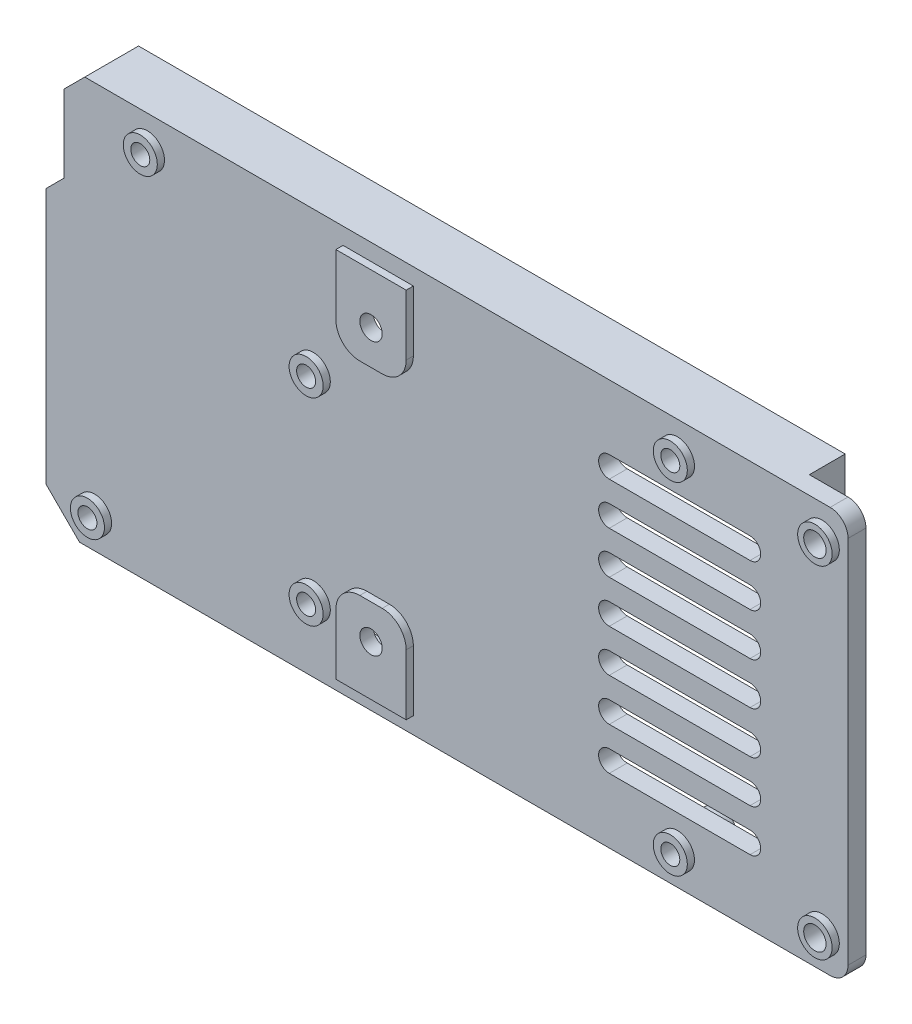
from build123d import *
from build123d.topology import SkipClean

# Parameters (mm, degrees)
BOSS_EXTRUDE2_DEPTH = 5.08
SKETCH3_R           = 1.5875
SKETCH3_R_2         = 1.3462
BOSS_EXTRUDE3_DEPTH = 2.54
BOSS_EXTRUDE4_START = 3.4671
SKETCH4_R           = 2.413
SKETCH4_R_2         = 1.3462
BOSS_EXTRUDE4_DEPTH = 3.4671
CUT_EXTRUDE1_REACH  = 69.495
SKETCH6_R           = 2.413
SKETCH6_R_2         = 1.3462
SKETCH6_R_3         = 2.44475
SKETCH6_R_4         = 1.5875
BOSS_EXTRUDE5_DEPTH = 1.016
CUT_EXTRUDE2_DEPTH  = 1.6383
CUT_EXTRUDE3_REACH  = 69.638
SKETCH9_R           = 1.5875
FILLET1_R           = 2.54


with BuildPart() as part:
    # Sketch2 → Boss-Extrude2 (new body)
    with BuildSketch(Plane.XY):
        Polygon((52.832, 28.7401), (-47.338246659, 28.7401), (-50.292, 25.786346659), (-50.292, 14.849781959), (-52.832, 12.309781959), (-52.832, -23.993781959), (-48.085681959, -28.7401), (52.832, -28.7401), align=None)
        Polygon((50.8, 26.7081), (-46.4965647, 26.7081), (-48.26, 24.9446647), (-48.26, 14.0081), (-50.8, 11.4681), (-50.8, -23.1521), (-47.244, -26.7081), (50.8, -26.7081), align=None, mode=Mode.SUBTRACT)
    extrude(amount=BOSS_EXTRUDE2_DEPTH)

    # Sketch3 → Boss-Extrude3 (add)
    with BuildSketch(Plane.XY.offset(5.08)):
        Polygon((-48.085681959, -28.7401), (60.8584, -28.7401), (60.8584, 28.7401), (-47.338246659, 28.7401), (-50.292, 25.786346659), (-50.292, 14.849781959), (-52.832, 12.309781959), (-52.832, -23.993781959), align=None)
        with Locations((57.1754, 24.1681)):
            Circle(SKETCH3_R, mode=Mode.SUBTRACT)
        with Locations((57.1754, -24.1681)):
            Circle(SKETCH3_R, mode=Mode.SUBTRACT)
        with Locations((36.6776, 24.1681)):
            Circle(SKETCH3_R_2, mode=Mode.SUBTRACT)
        with Locations((-38.4556, 24.1681)):
            Circle(SKETCH3_R_2, mode=Mode.SUBTRACT)
        with Locations((-14.9479, 8.726592766)):
            Circle(SKETCH3_R_2, mode=Mode.SUBTRACT)
        with Locations((-14.9479, -19.289607234)):
            Circle(SKETCH3_R_2, mode=Mode.SUBTRACT)
        with Locations((-45.9486, -24.1681)):
            Circle(SKETCH3_R_2, mode=Mode.SUBTRACT)
        with Locations((36.6776, -24.1681)):
            Circle(SKETCH3_R_2, mode=Mode.SUBTRACT)
    extrude(amount=BOSS_EXTRUDE3_DEPTH)

    # Sketch4 → Boss-Extrude4 (add)
    # profile 1 of 6: a face of its own
    with SkipClean():  # the faces are left unmerged after this step: merging them gives an invalid solid
        with BuildSketch(Plane(origin=(0, 0, 5.08), x_dir=(-1, 0, 0), z_dir=(0, 0, -1)).offset(BOSS_EXTRUDE4_START)):
            with Locations((14.9479, 8.726592766)):
                Circle(SKETCH4_R)
            with Locations((14.9479, 8.726592766)):
                Circle(SKETCH4_R_2, mode=Mode.SUBTRACT)
        # profile 2 of 6: a face of its own
        with BuildSketch(Plane(origin=(0, 0, 5.08), x_dir=(-1, 0, 0), z_dir=(0, 0, -1)).offset(BOSS_EXTRUDE4_START)):
            with Locations((14.9479, -19.289607234)):
                Circle(SKETCH4_R)
            with Locations((14.9479, -19.289607234)):
                Circle(SKETCH4_R_2, mode=Mode.SUBTRACT)
        # profile 3 of 6: a face of its own
        with BuildSketch(Plane(origin=(0, 0, 5.08), x_dir=(-1, 0, 0), z_dir=(0, 0, -1)).offset(BOSS_EXTRUDE4_START)):
            with BuildLine():
                Line((-39.0906, 24.1681), (-39.0906, 26.7081))
                Line((-39.0906, 26.7081), (-34.2646, 26.7081))
                Line((-34.2646, 26.7081), (-34.2646, 24.1681))
                ThreePointArc((-34.2646, 24.1681), (-36.6776, 21.7551), (-39.0906, 24.1681))
            make_face()
            with Locations((-36.6776, 24.1681)):
                Circle(SKETCH4_R_2, mode=Mode.SUBTRACT)
        # profile 4 of 6: a face of its own
        with BuildSketch(Plane(origin=(0, 0, 5.08), x_dir=(-1, 0, 0), z_dir=(0, 0, -1)).offset(BOSS_EXTRUDE4_START)):
            with BuildLine():
                Line((36.0426, 24.1681), (36.0426, 26.7081))
                Line((36.0426, 26.7081), (40.8686, 26.7081))
                Line((40.8686, 26.7081), (40.8686, 24.1681))
                ThreePointArc((40.8686, 24.1681), (38.4556, 21.7551), (36.0426, 24.1681))
            make_face()
            with Locations((38.4556, 24.1681)):
                Circle(SKETCH4_R_2, mode=Mode.SUBTRACT)
        # profile 5 of 6: a face of its own
        with BuildSketch(Plane(origin=(0, 0, 5.08), x_dir=(-1, 0, 0), z_dir=(0, 0, -1)).offset(BOSS_EXTRUDE4_START)):
            with BuildLine():
                Line((48.3616, -24.1681), (49.784, -24.1681))
                Line((49.784, -24.1681), (47.244, -26.7081))
                Line((47.244, -26.7081), (43.5356, -26.7081))
                Line((43.5356, -26.7081), (43.5356, -24.1681))
                ThreePointArc((43.5356, -24.1681), (45.9486, -21.7551), (48.3616, -24.1681))
            make_face()
            with Locations((45.9486, -24.1681)):
                Circle(SKETCH4_R_2, mode=Mode.SUBTRACT)
        # profile 6 of 6: a face of its own
        with BuildSketch(Plane(origin=(0, 0, 5.08), x_dir=(-1, 0, 0), z_dir=(0, 0, -1)).offset(BOSS_EXTRUDE4_START)):
            with BuildLine():
                Line((-39.0906, -24.1681), (-39.0906, -26.7081))
                Line((-39.0906, -26.7081), (-34.2646, -26.7081))
                Line((-34.2646, -26.7081), (-34.2646, -24.1681))
                ThreePointArc((-34.2646, -24.1681), (-36.6776, -21.7551), (-39.0906, -24.1681))
            make_face()
            with Locations((-36.6776, -24.1681)):
                Circle(SKETCH4_R_2, mode=Mode.SUBTRACT)
        extrude(amount=-BOSS_EXTRUDE4_DEPTH)

    # Sketch5 → Cut-Extrude1 (cut, up to next)
    with BuildSketch(Plane(origin=(0, 0, 5.08), x_dir=(-1, 0, 0), z_dir=(0, 0, -1)), mode=Mode.PRIVATE) as cut_extrude1_sk1:
        with BuildLine():
            Line((-46.9646, 19.5707), (-27.0129, 19.5707))
            ThreePointArc((-27.0129, 19.5707), (-25.5016, 18.0594), (-27.0129, 16.5481))
            Line((-27.0129, 16.5481), (-46.9646, 16.5481))
            ThreePointArc((-46.9646, 16.5481), (-48.4759, 18.0594), (-46.9646, 19.5707))
        make_face()
    cut_extrude1_tool1 = extrude(cut_extrude1_sk1.sketch, amount=-CUT_EXTRUDE1_REACH, mode=Mode.PRIVATE) & part.part
    # Sketch5 → Cut-Extrude1 (cut, up to next)
    with BuildSketch(Plane(origin=(0, 0, 5.08), x_dir=(-1, 0, 0), z_dir=(0, 0, -1)), mode=Mode.PRIVATE) as cut_extrude1_sk2:
        with BuildLine():
            Line((-46.9646, 13.5509), (-27.0129, 13.5509))
            ThreePointArc((-27.0129, 13.5509), (-25.5016, 12.0396), (-27.0129, 10.5283))
            Line((-27.0129, 10.5283), (-46.9646, 10.5283))
            ThreePointArc((-46.9646, 10.5283), (-48.4759, 12.0396), (-46.9646, 13.5509))
        make_face()
    cut_extrude1_tool2 = extrude(cut_extrude1_sk2.sketch, amount=-CUT_EXTRUDE1_REACH, mode=Mode.PRIVATE) & part.part
    # Sketch5 → Cut-Extrude1 (cut, up to next)
    with BuildSketch(Plane(origin=(0, 0, 5.08), x_dir=(-1, 0, 0), z_dir=(0, 0, -1)), mode=Mode.PRIVATE) as cut_extrude1_sk3:
        with BuildLine():
            Line((-46.9646, 7.5311), (-27.0129, 7.5311))
            ThreePointArc((-27.0129, 7.5311), (-25.5016, 6.0198), (-27.0129, 4.5085))
            Line((-27.0129, 4.5085), (-46.9646, 4.5085))
            ThreePointArc((-46.9646, 4.5085), (-48.4759, 6.0198), (-46.9646, 7.5311))
        make_face()
    cut_extrude1_tool3 = extrude(cut_extrude1_sk3.sketch, amount=-CUT_EXTRUDE1_REACH, mode=Mode.PRIVATE) & part.part
    # Sketch5 → Cut-Extrude1 (cut, up to next)
    with BuildSketch(Plane(origin=(0, 0, 5.08), x_dir=(-1, 0, 0), z_dir=(0, 0, -1)), mode=Mode.PRIVATE) as cut_extrude1_sk4:
        with BuildLine():
            Line((-46.9646, 1.5113), (-27.0129, 1.5113))
            ThreePointArc((-27.0129, 1.5113), (-25.5016, 0), (-27.0129, -1.5113))
            Line((-27.0129, -1.5113), (-46.9646, -1.5113))
            ThreePointArc((-46.9646, -1.5113), (-48.4759, 0), (-46.9646, 1.5113))
        make_face()
    cut_extrude1_tool4 = extrude(cut_extrude1_sk4.sketch, amount=-CUT_EXTRUDE1_REACH, mode=Mode.PRIVATE) & part.part
    # Sketch5 → Cut-Extrude1 (cut, up to next)
    with BuildSketch(Plane(origin=(0, 0, 5.08), x_dir=(-1, 0, 0), z_dir=(0, 0, -1)), mode=Mode.PRIVATE) as cut_extrude1_sk5:
        with BuildLine():
            Line((-46.9646, -4.5085), (-27.0129, -4.5085))
            ThreePointArc((-27.0129, -4.5085), (-25.5016, -6.0198), (-27.0129, -7.5311))
            Line((-27.0129, -7.5311), (-46.9646, -7.5311))
            ThreePointArc((-46.9646, -7.5311), (-48.4759, -6.0198), (-46.9646, -4.5085))
        make_face()
    cut_extrude1_tool5 = extrude(cut_extrude1_sk5.sketch, amount=-CUT_EXTRUDE1_REACH, mode=Mode.PRIVATE) & part.part
    # Sketch5 → Cut-Extrude1 (cut, up to next)
    with BuildSketch(Plane(origin=(0, 0, 5.08), x_dir=(-1, 0, 0), z_dir=(0, 0, -1)), mode=Mode.PRIVATE) as cut_extrude1_sk6:
        with BuildLine():
            Line((-46.9646, -10.5283), (-27.0129, -10.5283))
            ThreePointArc((-27.0129, -10.5283), (-25.5016, -12.0396), (-27.0129, -13.5509))
            Line((-27.0129, -13.5509), (-46.9646, -13.5509))
            ThreePointArc((-46.9646, -13.5509), (-48.4759, -12.0396), (-46.9646, -10.5283))
        make_face()
    cut_extrude1_tool6 = extrude(cut_extrude1_sk6.sketch, amount=-CUT_EXTRUDE1_REACH, mode=Mode.PRIVATE) & part.part
    # Sketch5 → Cut-Extrude1 (cut, up to next)
    with BuildSketch(Plane(origin=(0, 0, 5.08), x_dir=(-1, 0, 0), z_dir=(0, 0, -1)), mode=Mode.PRIVATE) as cut_extrude1_sk7:
        with BuildLine():
            Line((-46.9646, -16.5481), (-27.0129, -16.5481))
            ThreePointArc((-27.0129, -16.5481), (-25.5016, -18.0594), (-27.0129, -19.5707))
            Line((-27.0129, -19.5707), (-46.9646, -19.5707))
            ThreePointArc((-46.9646, -19.5707), (-48.4759, -18.0594), (-46.9646, -16.5481))
        make_face()
    cut_extrude1_tool7 = extrude(cut_extrude1_sk7.sketch, amount=-CUT_EXTRUDE1_REACH, mode=Mode.PRIVATE) & part.part
    add(cut_extrude1_tool1.solids().sort_by_distance((36.98875, 18.0594, 5.08))[0], mode=Mode.SUBTRACT)
    add(cut_extrude1_tool2.solids().sort_by_distance((36.98875, 12.0396, 5.08))[0], mode=Mode.SUBTRACT)
    add(cut_extrude1_tool3.solids().sort_by_distance((36.98875, 6.0198, 5.08))[0], mode=Mode.SUBTRACT)
    add(cut_extrude1_tool4.solids().sort_by_distance((36.98875, 0, 5.08))[0], mode=Mode.SUBTRACT)
    add(cut_extrude1_tool5.solids().sort_by_distance((36.98875, -6.0198, 5.08))[0], mode=Mode.SUBTRACT)
    add(cut_extrude1_tool6.solids().sort_by_distance((36.98875, -12.0396, 5.08))[0], mode=Mode.SUBTRACT)
    add(cut_extrude1_tool7.solids().sort_by_distance((36.98875, -18.0594, 5.08))[0], mode=Mode.SUBTRACT)

    # Sketch6 → Boss-Extrude5 (add)
    # profile 1 of 10: a face of its own
    with BuildSketch(Plane.XY.offset(7.62)):
        with Locations(Location((-14.9479, -19.289607234, 0), (0, 0, 180))):
            Circle(SKETCH6_R)
        with Locations(Location((-14.9479, -19.289607234, 0), (0, 0, 180))):
            Circle(SKETCH6_R_2, mode=Mode.SUBTRACT)
    # profile 2 of 10: a face of its own
    with BuildSketch(Plane.XY.offset(7.62)):
        with Locations(Location((-14.9479, 8.726592766, 0), (0, 0, 180))):
            Circle(SKETCH6_R)
        with Locations(Location((-14.9479, 8.726592766, 0), (0, 0, 180))):
            Circle(SKETCH6_R_2, mode=Mode.SUBTRACT)
    # profile 3 of 10: a face of its own
    with BuildSketch(Plane.XY.offset(7.62)):
        with Locations(Location((-45.9486, -24.1681, 0), (0, 0, 180))):
            Circle(SKETCH6_R)
        with Locations(Location((-45.9486, -24.1681, 0), (0, 0, 180))):
            Circle(SKETCH6_R_2, mode=Mode.SUBTRACT)
    # profile 4 of 10: a face of its own
    with BuildSketch(Plane.XY.offset(7.62)):
        with Locations(Location((-38.4556, 24.1681, 0), (0, 0, 180))):
            Circle(SKETCH6_R)
        with Locations(Location((-38.4556, 24.1681, 0), (0, 0, 180))):
            Circle(SKETCH6_R_2, mode=Mode.SUBTRACT)
    # profile 5 of 10: a face of its own
    with BuildSketch(Plane.XY.offset(7.62)):
        with Locations(Location((36.6776, 24.1681, 0), (0, 0, 180))):
            Circle(SKETCH6_R)
        with Locations(Location((36.6776, 24.1681, 0), (0, 0, 180))):
            Circle(SKETCH6_R_2, mode=Mode.SUBTRACT)
    # profile 6 of 10: a face of its own
    with BuildSketch(Plane.XY.offset(7.62)):
        with Locations(Location((36.6776, -24.1681, 0), (0, 0, 180))):
            Circle(SKETCH6_R)
        with Locations(Location((36.6776, -24.1681, 0), (0, 0, 180))):
            Circle(SKETCH6_R_2, mode=Mode.SUBTRACT)
    # profile 7 of 10: a face of its own
    with BuildSketch(Plane.XY.offset(7.62)):
        with Locations(Location((57.1754, 24.1681, 0), (0, 0, 180))):
            Circle(SKETCH6_R_3)
        with Locations((57.1754, 24.1681)):
            Circle(SKETCH6_R_4, mode=Mode.SUBTRACT)
    # profile 8 of 10: a face of its own
    with BuildSketch(Plane.XY.offset(7.62)):
        with Locations(Location((57.1754, -24.1681, 0), (0, 0, 180))):
            Circle(SKETCH6_R_3)
        with Locations((57.1754, -24.1681)):
            Circle(SKETCH6_R_4, mode=Mode.SUBTRACT)
    # profile 9 of 10: a face of its own
    with BuildSketch(Plane.XY.offset(7.62)):
        with BuildLine():
            Line((-7.33425, -14.3891), (-4.15925, -14.3891))
            ThreePointArc((-4.15925, -14.3891), (-1.757031488, -15.384131488), (-0.762, -17.78635))
            Line((-0.762, -17.78635), (-0.762, -26.3779))
            Line((-0.762, -26.3779), (-10.7315, -26.3779))
            Line((-10.7315, -26.3779), (-10.7315, -17.78635))
            ThreePointArc((-10.7315, -17.78635), (-9.736468512, -15.384131488), (-7.33425, -14.3891))
        make_face()
        with Locations((-5.74675, -19.289607234)):
            Circle(SKETCH6_R_4, mode=Mode.SUBTRACT)
    # profile 10 of 10: a face of its own
    with BuildSketch(Plane.XY.offset(7.62)):
        with BuildLine():
            Line((-10.7315, 26.3779), (-10.7315, 17.78635))
            ThreePointArc((-10.7315, 17.78635), (-9.736468512, 15.384131488), (-7.33425, 14.3891))
            Line((-7.33425, 14.3891), (-4.15925, 14.3891))
            ThreePointArc((-4.15925, 14.3891), (-1.757031488, 15.384131488), (-0.762, 17.78635))
            Line((-0.762, 17.78635), (-0.762, 26.3779))
            Line((-0.762, 26.3779), (-10.7315, 26.3779))
        make_face()
        with Locations(Location((-5.74675, 19.289607234, 0), (0, 0, 180))):
            Circle(SKETCH6_R_4, mode=Mode.SUBTRACT)
    extrude(amount=BOSS_EXTRUDE5_DEPTH)

    # Sketch8 → Cut-Extrude2 (cut)
    with BuildSketch(Plane(origin=(0, 0, 5.08), x_dir=(-1, 0, 0), z_dir=(0, 0, -1))):
        with BuildLine():
            Line((9.8425, 17.78635), (9.8425, 25.4889))
            Line((9.8425, 25.4889), (1.651, 25.4889))
            Line((1.651, 25.4889), (1.651, 17.78635))
            ThreePointArc((1.651, 17.78635), (2.385649416, 16.012749416), (4.15925, 15.2781))
            Line((4.15925, 15.2781), (7.33425, 15.2781))
            ThreePointArc((7.33425, 15.2781), (9.107850584, 16.012749416), (9.8425, 17.78635))
        make_face()
        with BuildLine():
            Line((1.651, -25.4889), (9.8425, -25.4889))
            Line((9.8425, -25.4889), (9.8425, -17.78635))
            ThreePointArc((9.8425, -17.78635), (9.107850584, -16.012749416), (7.33425, -15.2781))
            Line((7.33425, -15.2781), (4.15925, -15.2781))
            ThreePointArc((4.15925, -15.2781), (2.385649416, -16.012749416), (1.651, -17.78635))
            Line((1.651, -17.78635), (1.651, -25.4889))
        make_face()
    extrude(amount=-CUT_EXTRUDE2_DEPTH, mode=Mode.SUBTRACT)

    # Sketch9 → Cut-Extrude3 (cut, up to next)
    with BuildSketch(Plane(origin=(0, 0, 6.7183), x_dir=(-1, 0, 0), z_dir=(0, 0, -1)), mode=Mode.PRIVATE) as cut_extrude3_sk1:
        with Locations((5.74675, -19.289607234)):
            Circle(SKETCH9_R)
    cut_extrude3_tool1 = extrude(cut_extrude3_sk1.sketch, amount=-CUT_EXTRUDE3_REACH, mode=Mode.PRIVATE) & part.part
    # Sketch9 → Cut-Extrude3 (cut, up to next)
    with BuildSketch(Plane(origin=(0, 0, 6.7183), x_dir=(-1, 0, 0), z_dir=(0, 0, -1)), mode=Mode.PRIVATE) as cut_extrude3_sk2:
        with Locations((5.74675, 19.289607234)):
            Circle(SKETCH9_R)
    cut_extrude3_tool2 = extrude(cut_extrude3_sk2.sketch, amount=-CUT_EXTRUDE3_REACH, mode=Mode.PRIVATE) & part.part
    add(cut_extrude3_tool1.solids().sort_by_distance((-5.74675, -19.289607, 6.7183))[0], mode=Mode.SUBTRACT)
    add(cut_extrude3_tool2.solids().sort_by_distance((-5.74675, 19.289607, 6.7183))[0], mode=Mode.SUBTRACT)

    # Fillet1
    fillet1_edges = [part.edges().sort_by_distance(p)[0] for p in [
        (60.8584, -28.7401, 6.35),
        (60.8584, 28.7401, 6.35),
    ]]
    fillet(fillet1_edges, radius=FILLET1_R)


solid = part.part
